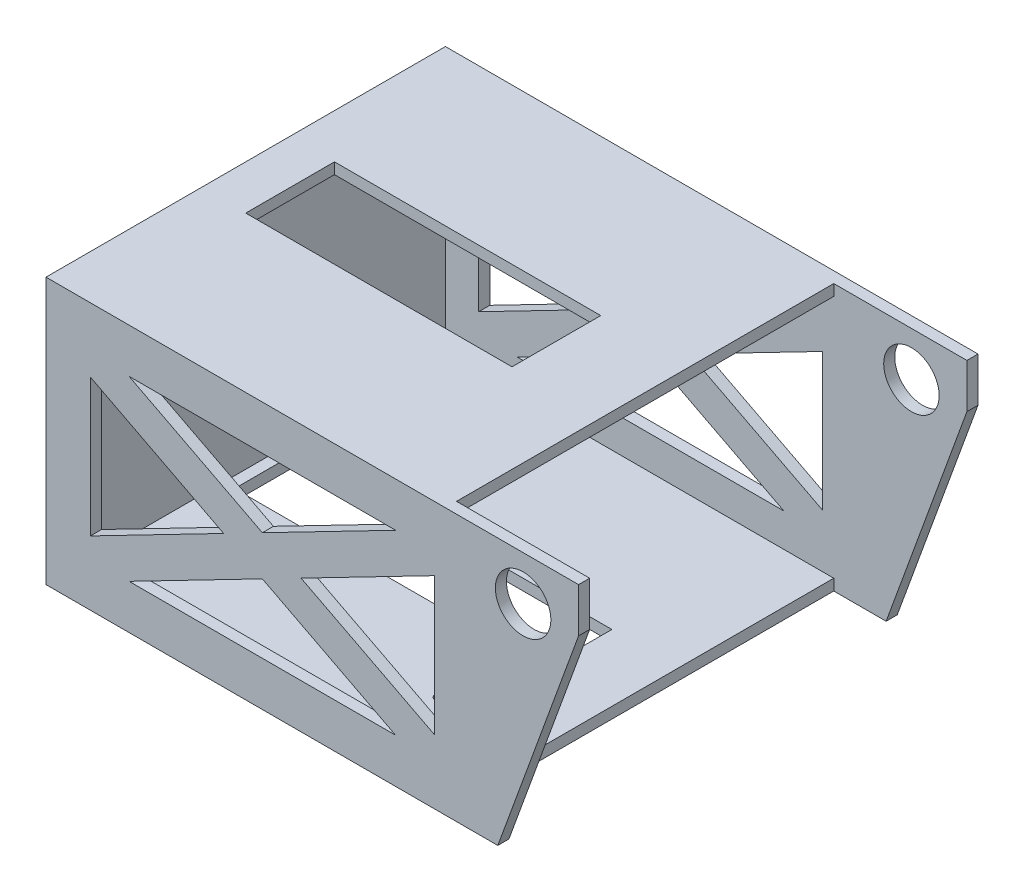
from build123d import *

# Parameters (mm, degrees)
SKETCH1_W               = 152.4
SKETCH1_H               = 114.3
BOSS_EXTRUDE1_DEPTH     = 76.2
CUT_EXTRUDE1_DEPTH      = 142.677746119
CUT_EXTRUDE1_DEPTH_BACK = 142.677746119
SKETCH5_W               = 38.1
SKETCH5_H               = 107.95
CUT_EXTRUDE4_DEPTH      = 142.677746119
CUT_EXTRUDE5_DEPTH      = 169.235334824
CUT_EXTRUDE5_DEPTH_BACK = 169.235334824
SKETCH6_R               = 7.9375
CUT_EXTRUDE6_START      = -114.3
SKETCH8_W               = 107.95
SKETCH8_H               = 69.85
CUT_EXTRUDE6_DEPTH      = 111.125
SKETCH9_R               = 1.5875
CUT_EXTRUDE7_DEPTH      = 3.175
SKETCH10_W              = 88.9
SKETCH10_H              = 19.05
CUT_EXTRUDE8_DEPTH      = 5.715
CUT_EXTRUDE9_DEPTH      = 169.235334824
SKETCH13_W              = 76.2
SKETCH13_H              = 25.4
CUT_EXTRUDE10_DEPTH     = 5.715


with BuildPart() as part:
    # Sketch1 → Boss-Extrude1 (new body)
    with BuildSketch(Plane(origin=(0, 0, 0), x_dir=(1, 0, 0), z_dir=(0, 1, 0))):
        with Locations((-20.919503106, -12.376583851)):
            Rectangle(SKETCH1_W, SKETCH1_H)
    extrude(amount=BOSS_EXTRUDE1_DEPTH)

    # Sketch3 → Cut-Extrude1 (cut, two sides: drawn at the far end of the back side and taken through both)
    with BuildSketch(Plane.XY.offset(-CUT_EXTRUDE1_DEPTH_BACK)):
        Polygon((55.280496894, 63.5), (32.168387019, 0), (55.280496894, 0), align=None)
    extrude(amount=CUT_EXTRUDE1_DEPTH + CUT_EXTRUDE1_DEPTH_BACK, mode=Mode.SUBTRACT)

    # Sketch5 → Cut-Extrude4 (cut, through all)
    with BuildSketch(Plane(origin=(0, 0, 0), x_dir=(1, 0, 0), z_dir=(0, 1, 0))):
        with Locations((36.230496894, -12.376583851)):
            Rectangle(SKETCH5_W, SKETCH5_H)
    extrude(amount=CUT_EXTRUDE4_DEPTH, mode=Mode.SUBTRACT)

    # Sketch6 → Cut-Extrude5 (cut, two sides: drawn at the far end of the back side and taken through both)
    with BuildSketch(Plane.XY.offset(69.526583851).offset(-CUT_EXTRUDE5_DEPTH_BACK)):
        with Locations((39.405496894, 63.5)):
            Circle(SKETCH6_R)
    extrude(amount=CUT_EXTRUDE5_DEPTH + CUT_EXTRUDE5_DEPTH_BACK, mode=Mode.SUBTRACT)

    # Sketch8 → Cut-Extrude6 (cut)
    with BuildSketch(Plane.ZY.offset(97.119503106).offset(CUT_EXTRUDE6_START)):
        with Locations((12.376583851, 38.1)):
            Rectangle(SKETCH8_W, SKETCH8_H)
    extrude(amount=CUT_EXTRUDE6_DEPTH, mode=Mode.SUBTRACT)

    # Sketch9 → Cut-Extrude7 (cut)
    with BuildSketch(Plane.XZ):
        with Locations(Location((4.480496894, 44.126583851, 0), (0, 0, 270))):
            Circle(SKETCH9_R)
        with Locations(Location((-9.489503106, 44.126583851, 0), (0, 0, 270))):
            Circle(SKETCH9_R)
    extrude(amount=-CUT_EXTRUDE7_DEPTH, mode=Mode.SUBTRACT)

    # Sketch10 → Cut-Extrude8 (cut)
    with BuildSketch(Plane.XZ):
        with Locations((-46.319503106, 12.376583851)):
            Rectangle(SKETCH10_W, SKETCH10_H)
    extrude(amount=-CUT_EXTRUDE8_DEPTH, mode=Mode.SUBTRACT)

    # Sketch12 → Cut-Extrude9 (cut, through all)
    with BuildSketch(Plane.XY.offset(69.526583851)):
        Polygon((-73.343348256, 63.5), (2.929342045, 63.5), (-35.207003106, 43.816725084), align=None)
        Polygon((-84.419503106, 57.783274916), (-84.419503106, 18.416725084), (-46.283157955, 38.1), align=None)
        Polygon((-73.343348256, 12.7), (2.929342045, 12.7), (-35.207003106, 32.383274916), align=None)
        Polygon((14.005496894, 57.783274916), (14.005496894, 18.416725084), (-24.130848256, 38.1), align=None)
    extrude(amount=-CUT_EXTRUDE9_DEPTH, mode=Mode.SUBTRACT)

    # Sketch13 → Cut-Extrude10 (cut)
    with BuildSketch(Plane(origin=(0, 76.2, 0), x_dir=(1, 0, 0), z_dir=(0, 1, 0))):
        with Locations((-46.319503106, -12.376583851)):
            Rectangle(SKETCH13_W, SKETCH13_H)
    extrude(amount=-CUT_EXTRUDE10_DEPTH, mode=Mode.SUBTRACT)


solid = part.part
